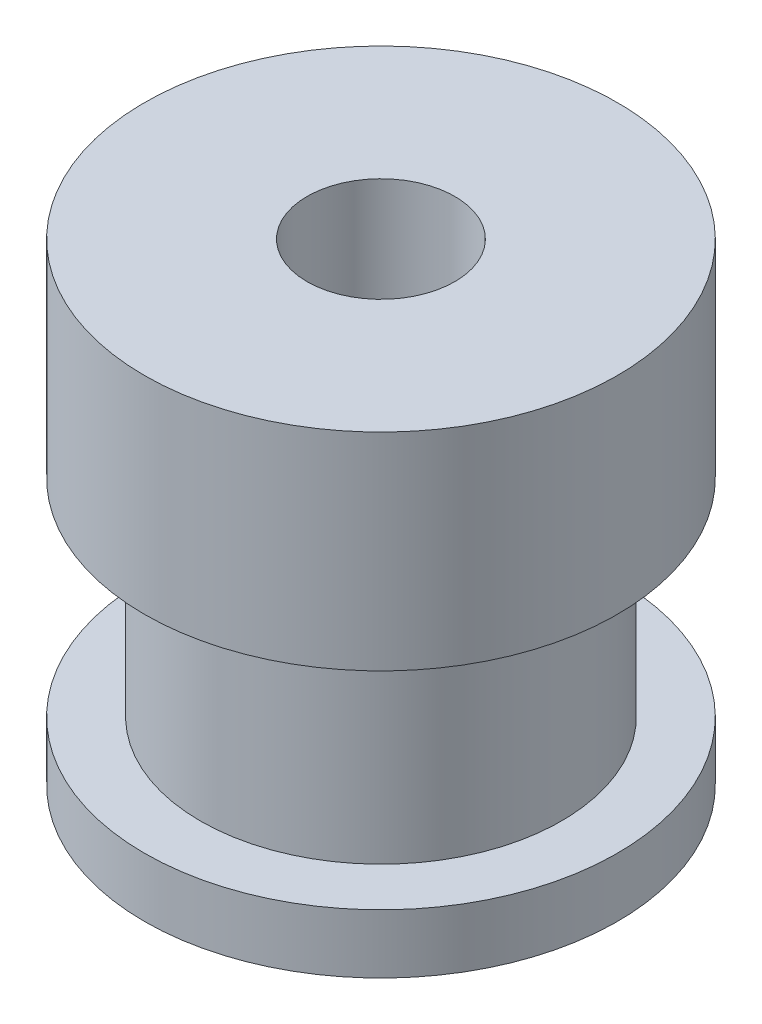
from build123d import *

# Parameters (mm, degrees)
SKETCH_1_R          = 8
EXTRUDE_1_DEPTH     = 2
SKETCH_2_R          = 6.11
EXTRUDE_2_DEPTH     = 7
SKETCH_3_R          = 8
EXTRUDE_3_DEPTH     = 7
SKETCH_4_R          = 2.5
CUT_EXTRUDE_1_DEPTH = 24


with BuildPart() as part:
    # 草图1 → 凸台-拉伸1 (new body)
    with BuildSketch(Plane(origin=(0, 0, 0), x_dir=(1, 0, 0), z_dir=(0, 1, 0))):
        with Locations(Location((0, 0, 0), (0, 0, 270))):
            Circle(SKETCH_1_R)
    extrude(amount=EXTRUDE_1_DEPTH)

    # 草图2 → 凸台-拉伸2 (add)
    with BuildSketch(Plane(origin=(0, 2, 0), x_dir=(1, 0, 0), z_dir=(0, 1, 0))):
        with Locations(Location((0, 0, 0), (0, 0, 270))):
            Circle(SKETCH_2_R)
    extrude(amount=EXTRUDE_2_DEPTH)

    # 草图3 → 凸台-拉伸3 (add)
    with BuildSketch(Plane(origin=(0, 9, 0), x_dir=(1, 0, 0), z_dir=(0, 1, 0))):
        with Locations(Location((0, 0, 0), (0, 0, 270))):
            Circle(SKETCH_3_R)
    extrude(amount=EXTRUDE_3_DEPTH)

    # 草图4 → 切除-拉伸1 (cut)
    with BuildSketch(Plane(origin=(0, 16, 0), x_dir=(1, 0, 0), z_dir=(0, 1, 0))):
        with Locations(Location((0, 0, 0), (0, 0, 270))):
            Circle(SKETCH_4_R)
    extrude(amount=-CUT_EXTRUDE_1_DEPTH, mode=Mode.SUBTRACT)


solid = part.part
